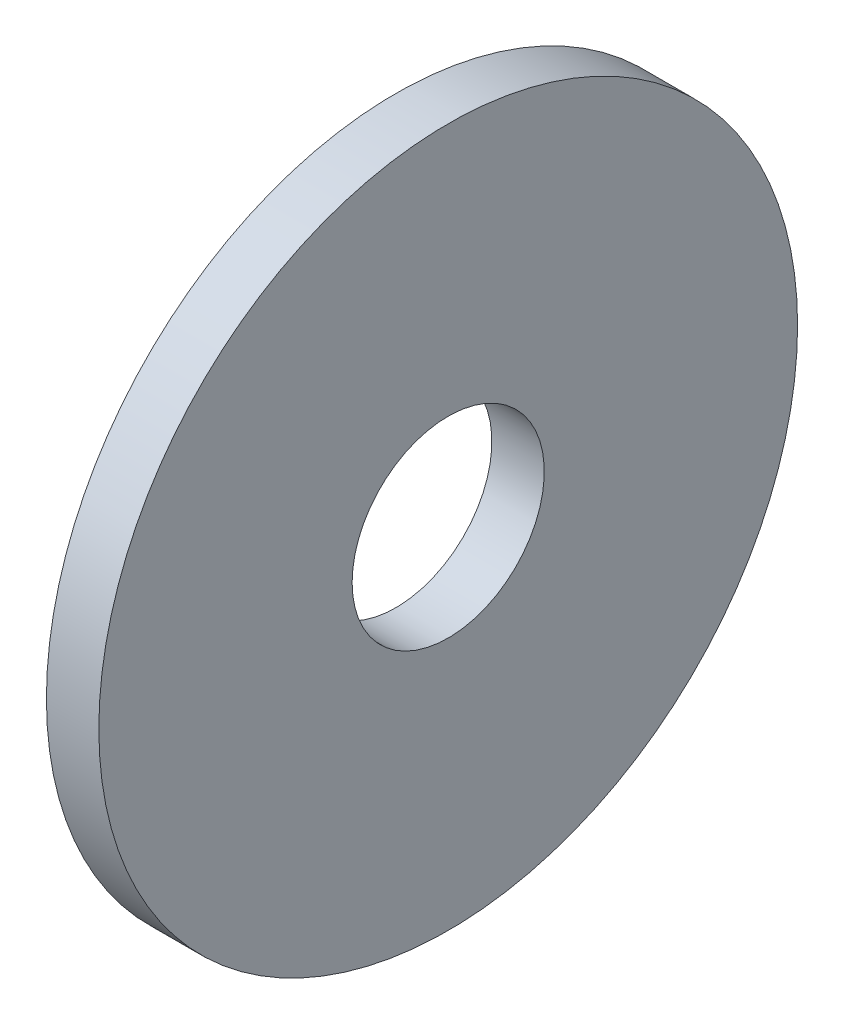
from build123d import *

# Parameters (mm, degrees)
SKETCH_1_R        = 20
SKETCH_1_R_2      = 5.5
EXTRUDE_367_DEPTH = 3


with BuildPart() as part:
    # 草圖1 → Extrude 367 (new body)
    with BuildSketch(Plane.YZ):
        with Locations(Location((0, 0, 0), (0, 0, 90))):
            Circle(SKETCH_1_R)
        with Locations(Location((0, 0, 0), (0, 0, 90))):
            Circle(SKETCH_1_R_2, mode=Mode.SUBTRACT)
    extrude(amount=EXTRUDE_367_DEPTH)


solid = part.part
